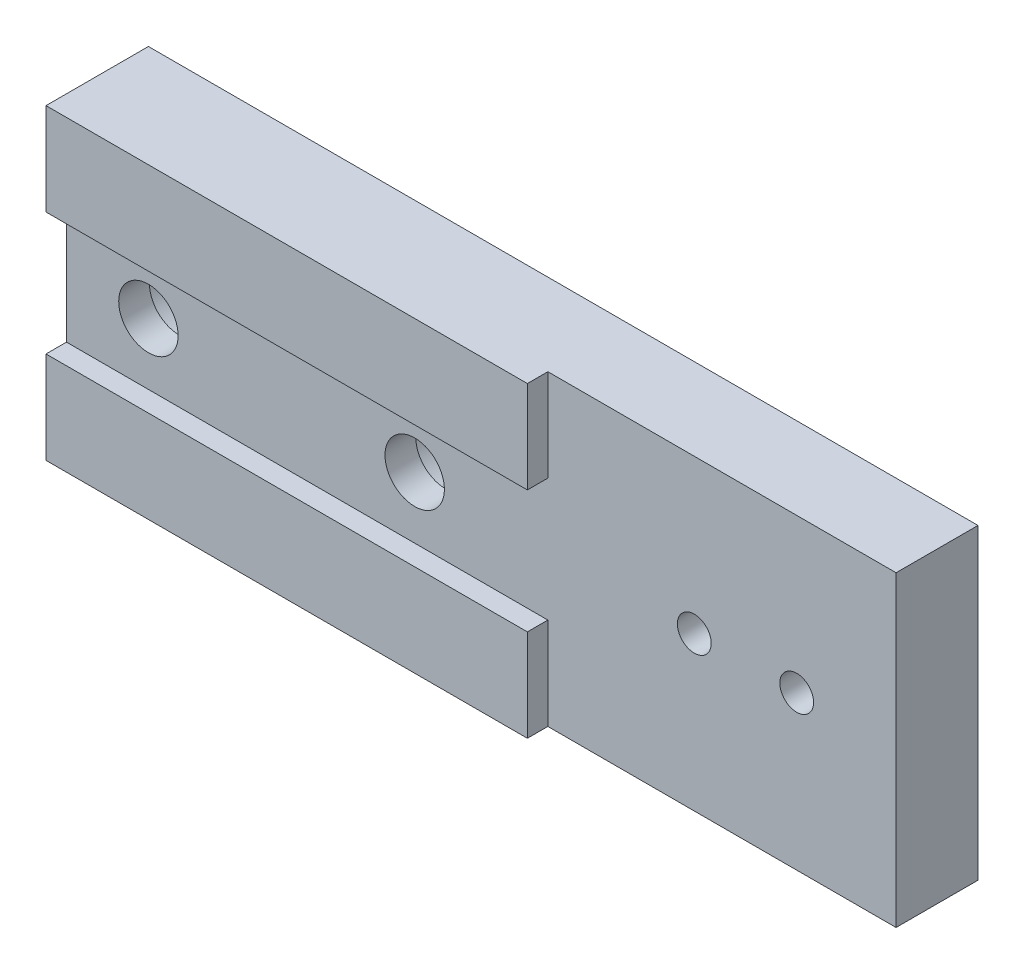
from build123d import *

# Parameters (mm, degrees)
SKETCH_1_W                   = 81
SKETCH_1_H                   = 30
EXTRUDE_1_DEPTH              = 10
HOLE_WIZARD_M5_1_D           = 5.8
HOLE_WIZARD_M5_1_CBORE_D     = 10
HOLE_WIZARD_M5_1_CBORE_DEPTH = 5
SKETCH_4_W                   = 81
SKETCH_4_H                   = 12
CUT_EXTRUDE_1_DEPTH          = 2
CUT_EXTRUDE_2_DEPTH          = 85.273364713
CUT_EXTRUDE_2_DEPTH_BACK     = 85.273364713
SKETCH_5_W                   = 34
SKETCH_5_H                   = 2
HOLE_WIZARD_M4_1_D           = 3.3


with BuildPart() as part:
    # 草图1 → 凸台-拉伸1 (new body)
    with BuildSketch(Plane.XY):
        with Locations((40.5, 15)):
            Rectangle(SKETCH_1_W, SKETCH_1_H)
    extrude(amount=EXTRUDE_1_DEPTH)

    # M5 六角凹头螺钉的柱形沉头孔1 (through all)
    with Locations(Plane(origin=(0, 0, 0), x_dir=(-1, 0, 0), z_dir=(0, 0, -1))):
        with Locations((-34, 15), (-8, 15)):
            CounterBoreHole(HOLE_WIZARD_M5_1_D / 2, HOLE_WIZARD_M5_1_CBORE_D / 2, HOLE_WIZARD_M5_1_CBORE_DEPTH)

    # 草图4 → 切除-拉伸1 (cut)
    with BuildSketch(Plane.XY.offset(10)):
        with Locations((40.5, 15)):
            Rectangle(SKETCH_4_W, SKETCH_4_H)
    extrude(amount=-CUT_EXTRUDE_1_DEPTH, mode=Mode.SUBTRACT)

    # 草图5 → 切除-拉伸2 (cut, two sides: drawn at the far end of the back side and taken through both)
    with BuildSketch(Plane.XZ.offset(-21).offset(-CUT_EXTRUDE_2_DEPTH_BACK)):
        with Locations((64, 9)):
            Rectangle(SKETCH_5_W, SKETCH_5_H)
    extrude(amount=CUT_EXTRUDE_2_DEPTH + CUT_EXTRUDE_2_DEPTH_BACK, mode=Mode.SUBTRACT)

    # M4 螺纹孔1 (through all)
    with Locations(Plane.XY.offset(8)):
        with Locations((71.3, 15), (61.3, 15)):
            Hole(HOLE_WIZARD_M4_1_D / 2)


solid = part.part
